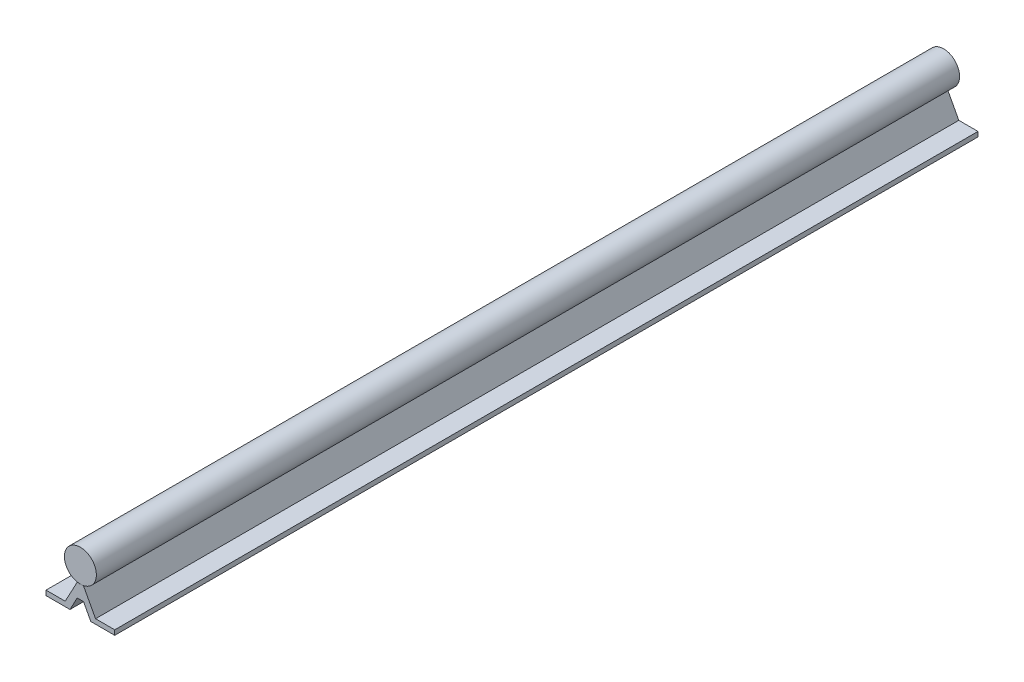
from build123d import *

# Parameters (mm, degrees)
CROQUIS1_R                = 10
SALIENTE_EXTRUIR1_DEPTH   = 540
SALIENTE_EXTRUIR1_2_DEPTH = 540


with BuildPart() as part:
    # Croquis1 → Saliente-Extruir1 (new body)
    with BuildSketch(Plane.XY):
        with Locations((0, 27)):
            Circle(CROQUIS1_R)
    extrude(amount=SALIENTE_EXTRUIR1_DEPTH)


with BuildPart() as body_2:
    # Croquis1 → Saliente-Extruir1 2 (new body)
    with BuildSketch(Plane.XY):
        Polygon((-6.5, 0), (-21.5, 0), (-21.5, 3), (-9.5, 3), (-2, 17), (2, 17), (9.5, 3), (21.5, 3), (21.5, 0), (6.5, 0), (2, 8.5), (-2, 8.5), align=None)
    extrude(amount=SALIENTE_EXTRUIR1_2_DEPTH)


solid = Compound([part.part, body_2.part])
